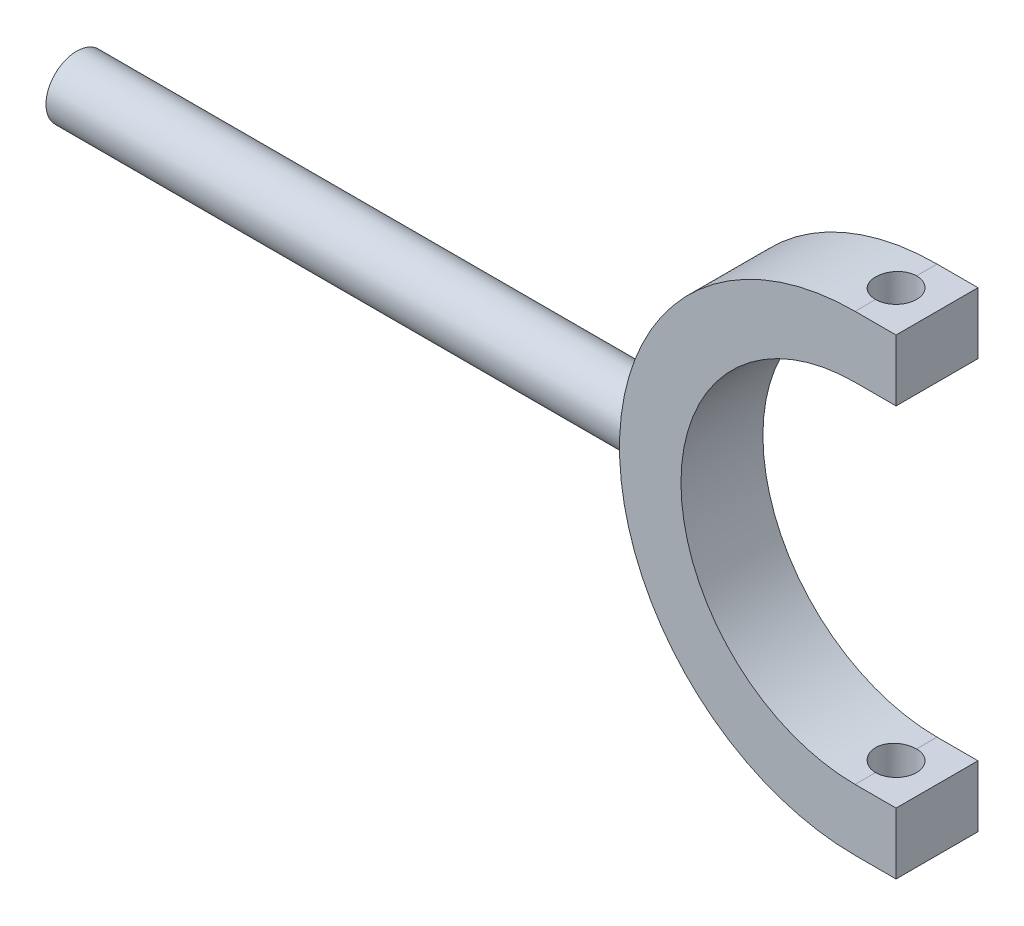
from build123d import *

# Parameters (mm, degrees)
CROQUIS2_R              = 7.5
SALIENTE_EXTRUIR1_DEPTH = 200
CROQUIS3_W              = 20
CROQUIS3_H              = 15
CORTAR_EXTRUIR1_START   = -100
CROQUIS5_R              = 42.5
CORTAR_EXTRUIR1_DEPTH   = 100
CROQUIS6_W              = 20
CROQUIS6_H              = 15
SALIENTE_EXTRUIR2_DEPTH = 10
CROQUIS8_R              = 5
CORTAR_EXTRUIR2_DEPTH   = 231.922064916


with BuildPart() as part:
    # Croquis2 → Saliente-Extruir1 (new body)
    with BuildSketch(Plane(origin=(0, 0, 0), x_dir=(0, 0, -1), z_dir=(1, 0, 0))):
        Circle(CROQUIS2_R)
    extrude(amount=-SALIENTE_EXTRUIR1_DEPTH)

    # Barrer1: sweep along a path in Croquis4
    with BuildLine(Plane.XY) as barrer1_path:
        ThreePointArc((0, 50), (-50, 0), (0, -50))
    # Croquis3 → Barrer1 (sweep)
    with BuildSketch(Plane(origin=(0, 0, 0), x_dir=(0, 0, -1), z_dir=(1, 0, 0))):
        with Locations((0, 50)):
            Rectangle(CROQUIS3_W, CROQUIS3_H)
    sweep(path=barrer1_path.line)

    # Croquis5 → Cortar-Extruir1 (cut)
    with BuildSketch(Plane.XY.offset(10).offset(CORTAR_EXTRUIR1_START)):
        Circle(CROQUIS5_R)
    extrude(amount=CORTAR_EXTRUIR1_DEPTH, mode=Mode.SUBTRACT)

    # Croquis6 → Saliente-Extruir2 (add)
    with BuildSketch(Plane(origin=(0, 0, 0), x_dir=(0, 0, -1), z_dir=(1, 0, 0))):
        with Locations((0, 50)):
            Rectangle(CROQUIS6_W, CROQUIS6_H)
    saliente_extruir2 = extrude(amount=SALIENTE_EXTRUIR2_DEPTH)

    # Simetría1: Saliente-Extruir2 across plane
    add(saliente_extruir2.mirror(Plane.ZX))

    # Croquis8 → Cortar-Extruir2 (cut, through all)
    with BuildSketch(Plane(origin=(0, 57.5, 0), x_dir=(1, 0, 0), z_dir=(0, 1, 0))):
        with Locations(Location((0, 0, 0), (0, 0, 270))):
            Circle(CROQUIS8_R)
    extrude(amount=-CORTAR_EXTRUIR2_DEPTH, mode=Mode.SUBTRACT)


solid = part.part
